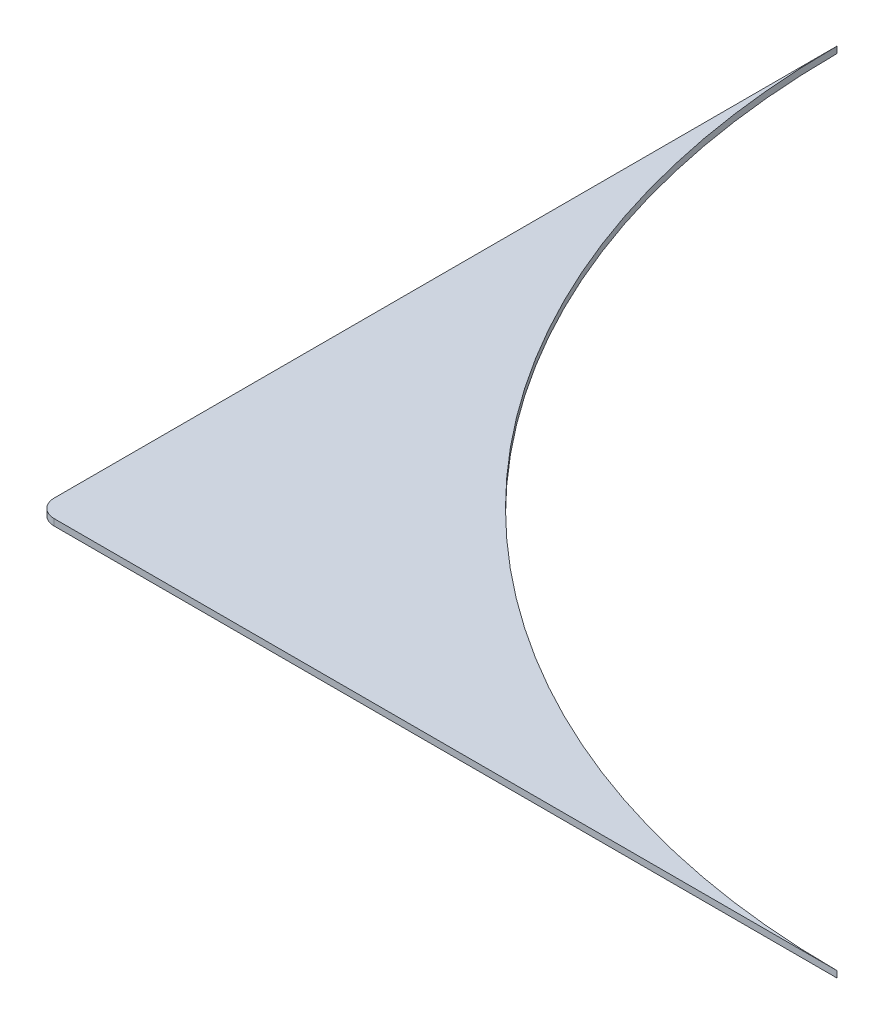
from build123d import *

# Parameters (mm, degrees)
BOSS_EXTRUDE1_DEPTH = 1.524


with BuildPart() as part:
    # Sketch1 → Boss-Extrude1 (new body)
    with BuildSketch(Plane(origin=(0, 0, 0), x_dir=(1, 0, 0), z_dir=(0, 1, 0))):
        with BuildLine():
            Line((-152.4, 0), (-152.4, -184.209))
            ThreePointArc((-152.4, -184.209), (-151.17248452, -187.17248452), (-148.209, -188.4))
            Line((-148.209, -188.4), (35.941, -188.4))
            ThreePointArc((35.941, -188.4), (-97.239776153, -133.198059559), (-152.4, 0))
        make_face()
    extrude(amount=BOSS_EXTRUDE1_DEPTH)


solid = part.part
